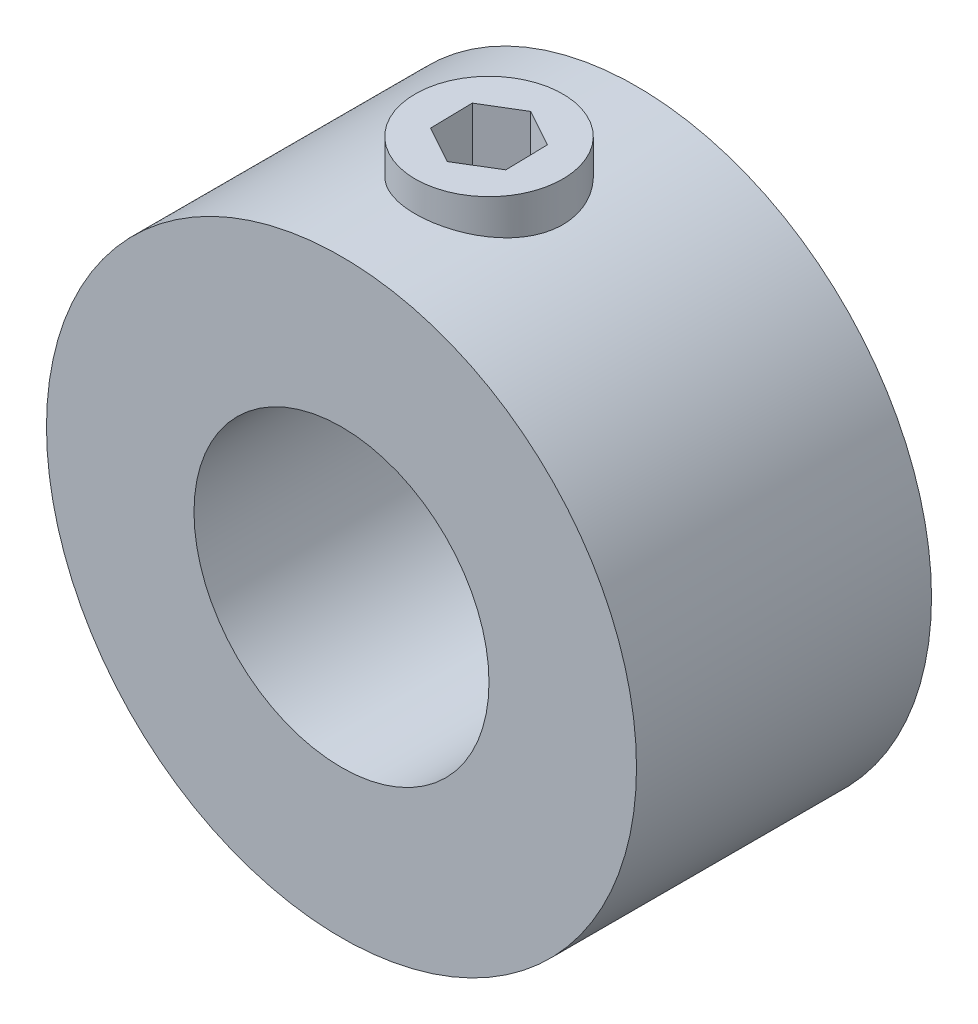
from build123d import *

# Parameters (mm, degrees)
SKETCH1_R            = 6.35
SKETCH1_R_2          = 3.175
BODY_DEPTH           = 6.35
SET_SCREW_REACH      = 18.089
SET_SCREW_END_RADIUS = 6.35
SKETCH2_R            = 1.5875
HEX_KEY_DEPTH        = 3


with BuildPart() as part:
    # Sketch1 → Body (new body)
    with BuildSketch(Plane.XY):
        Circle(SKETCH1_R)
        Circle(SKETCH1_R_2, mode=Mode.SUBTRACT)
    extrude(amount=BODY_DEPTH)

    # Set Screw: up to this cylinder (the profile starts outside it)
    set_screw_end = Plane(origin=(0, 0, 3.175), z_dir=(0, 0, -1)) * Cylinder(SET_SCREW_END_RADIUS, 49.878, mode=Mode.PRIVATE)
    # Sketch2 → Set Screw (add, up to the surface)
    with BuildSketch(Plane(origin=(0, 7, 0), x_dir=(1, 0, 0), z_dir=(0, 1, 0)), mode=Mode.PRIVATE) as set_screw_sk1:
        with Locations(Location((0, -3.175, 0), (0, 0, 270))):
            Circle(SKETCH2_R)
    set_screw_tool1 = extrude(set_screw_sk1.sketch, amount=-SET_SCREW_REACH, mode=Mode.PRIVATE) - set_screw_end
    add(set_screw_tool1.solids().sort_by_distance((0, 7, 3.175))[0])

    # Sketch3 → Hex Key (cut)
    with BuildSketch(Plane(origin=(0, 7, 0), x_dir=(1, 0, 0), z_dir=(0, 1, 0))):
        Polygon((0.802721832, -3.617368334), (0.784463132, -2.701006668), (-0.018258701, -2.258638334), (-0.802721832, -2.732631666), (-0.784463132, -3.648993332), (0.018258701, -4.091361666), align=None)
    extrude(amount=-HEX_KEY_DEPTH, mode=Mode.SUBTRACT)


solid = part.part
